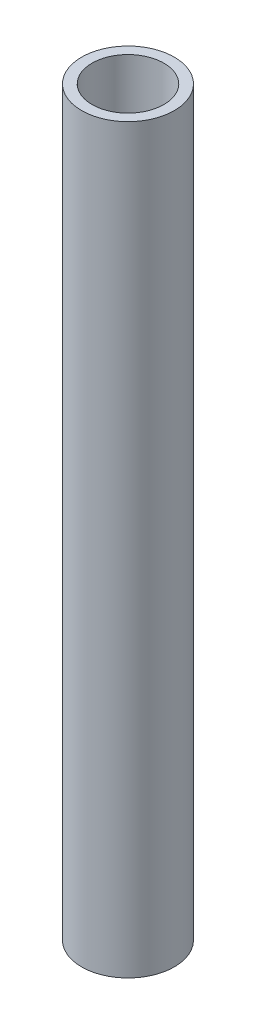
from build123d import *

# Parameters (mm, degrees)
SKETCH1_R           = 6.35
SKETCH1_R_2         = 4.92125
BOSS_EXTRUDE1_DEPTH = 101.6


with BuildPart() as part:
    # Sketch1 → Boss-Extrude1 (new body)
    with BuildSketch(Plane(origin=(0, 0, 0), x_dir=(1, 0, 0), z_dir=(0, 1, 0))):
        with Locations(Location((0, 0, 0), (0, 0, 270))):
            Circle(SKETCH1_R)
        with Locations(Location((0, 0, 0), (0, 0, 270))):
            Circle(SKETCH1_R_2, mode=Mode.SUBTRACT)
    extrude(amount=BOSS_EXTRUDE1_DEPTH)


solid = part.part
